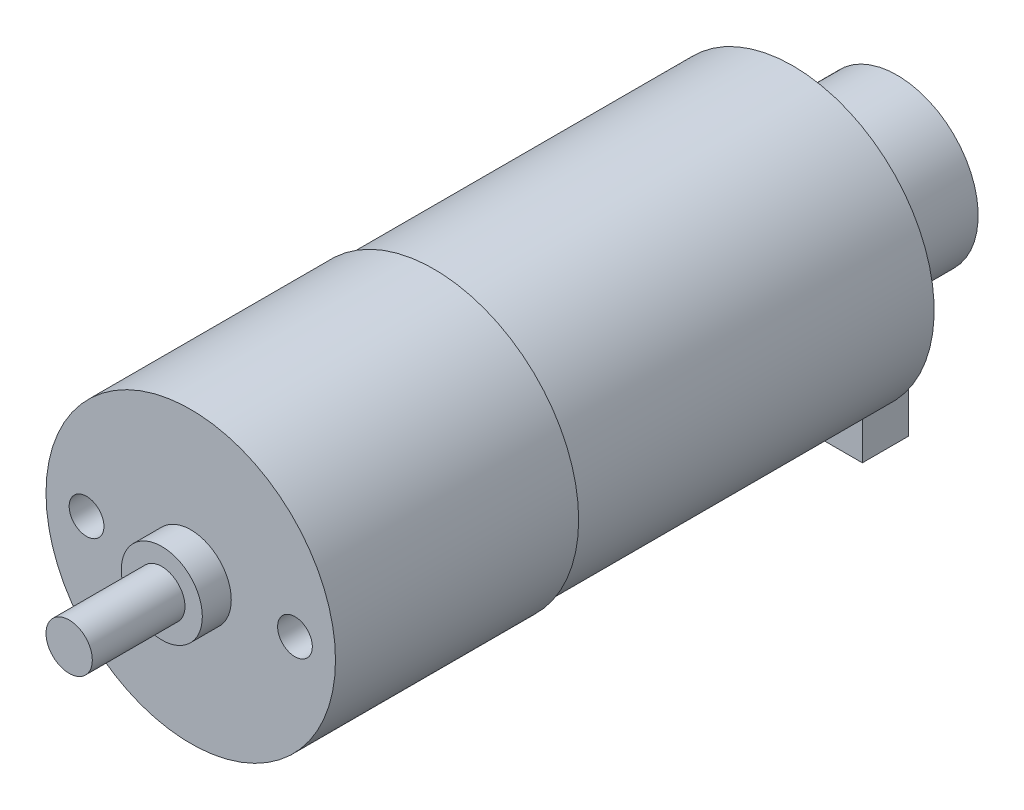
from build123d import *

# Parameters (mm, degrees)
SKETCH1_R           = 12.2
BOSS_EXTRUDE1_DEPTH = 31
SKETCH2_R           = 12.5
BOSS_EXTRUDE2_DEPTH = 21
SKETCH3_R           = 3.5
BOSS_EXTRUDE3_DEPTH = 2.5
SKETCH4_R           = 2
BOSS_EXTRUDE4_DEPTH = 8
SKETCH5_R           = 7
BOSS_EXTRUDE5_DEPTH = 9
SKETCH6_W           = 12
SKETCH6_H           = 7
BOSS_EXTRUDE6_DEPTH = 4
SKETCH7_R           = 1.5
CUT_EXTRUDE1_DEPTH  = 7


with BuildPart() as part:
    # Sketch1 → Boss-Extrude1 (new body)
    with BuildSketch(Plane.XY):
        Circle(SKETCH1_R)
    extrude(amount=BOSS_EXTRUDE1_DEPTH)

    # Sketch2 → Boss-Extrude2 (add)
    with BuildSketch(Plane.XY.offset(31)):
        with Locations(Location((0, 0, 0), (0, 0, 180))):
            Circle(SKETCH2_R)
    extrude(amount=BOSS_EXTRUDE2_DEPTH)

    # Sketch3 → Boss-Extrude3 (add)
    with BuildSketch(Plane.XY.offset(52)):
        Circle(SKETCH3_R)
    extrude(amount=BOSS_EXTRUDE3_DEPTH)

    # Sketch4 → Boss-Extrude4 (add)
    with BuildSketch(Plane.XY.offset(54.5)):
        Circle(SKETCH4_R)
    extrude(amount=BOSS_EXTRUDE4_DEPTH)

    # Sketch5 → Boss-Extrude5 (add)
    with BuildSketch(Plane(origin=(0, 0, 0), x_dir=(-1, 0, 0), z_dir=(0, 0, -1))):
        Circle(SKETCH5_R)
    extrude(amount=BOSS_EXTRUDE5_DEPTH)

    # Sketch6 → Boss-Extrude6 (add)
    with BuildSketch(Plane(origin=(0, 0, 0), x_dir=(-1, 0, 0), z_dir=(0, 0, -1))):
        with Locations((0, -11)):
            Rectangle(SKETCH6_W, SKETCH6_H)
    extrude(amount=BOSS_EXTRUDE6_DEPTH)

    # Sketch7 → Cut-Extrude1 (cut)
    with BuildSketch(Plane.XY.offset(52)):
        with Locations((-9, 0)):
            Circle(SKETCH7_R)
        with Locations((9, 0)):
            Circle(SKETCH7_R)
    extrude(amount=-CUT_EXTRUDE1_DEPTH, mode=Mode.SUBTRACT)


solid = part.part
